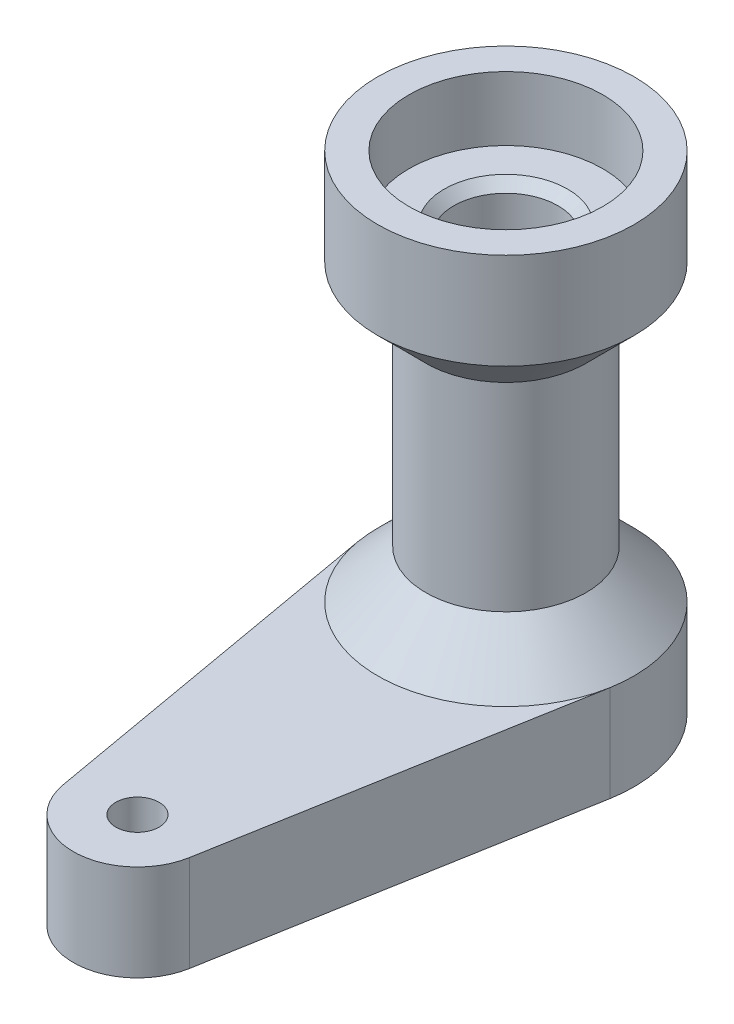
from build123d import *

# Parameters (mm, degrees)
ESQUISSE2_R        = 1.35
BOSS_EXTRU_2_DEPTH = 6


with BuildPart() as part:
    # Esquisse1 → Révolution1 (revolve)
    with BuildSketch(Plane.XY, mode=Mode.PRIVATE) as r_volution1_sk:
        Polygon((-6.05, 0), (-6.05, 4), (-3.85, 4), (-3.25, 4.6), (-3.25, 25.8), (-3.85, 26.4), (-6.05, 26.4), (-6.05, 30.4), (-8, 30.4), (-8, 24.4), (-5, 21.4), (-5, 9), (-8, 6), (-8, 0), align=None)
    revolve(r_volution1_sk.sketch.rotate(Axis((0, -1.144220684, 0), (0, 1, 0)), 270), axis=Axis((0, -1.144220684, 0), (0, 1, 0)))

    # Esquisse2 → Boss.-Extru.2 (add)
    with BuildSketch(Plane(origin=(0, 0, 0), x_dir=(1, 0, 0), z_dir=(0, 1, 0))):
        with BuildLine():
            Line((-7.878088106, -1.391304348), (-3.939044053, -23.695652174))
            ThreePointArc((-3.939044053, -23.695652174), (0, -27), (3.939044053, -23.695652174))
            Line((3.939044053, -23.695652174), (7.878088106, -1.391304348))
            ThreePointArc((7.878088106, -1.391304348), (0, -8), (-7.878088106, -1.391304348))
        make_face()
        with Locations(Location((0, -23, 0), (0, 0, 270))):
            Circle(ESQUISSE2_R, mode=Mode.SUBTRACT)
    extrude(amount=BOSS_EXTRU_2_DEPTH)


solid = part.part
